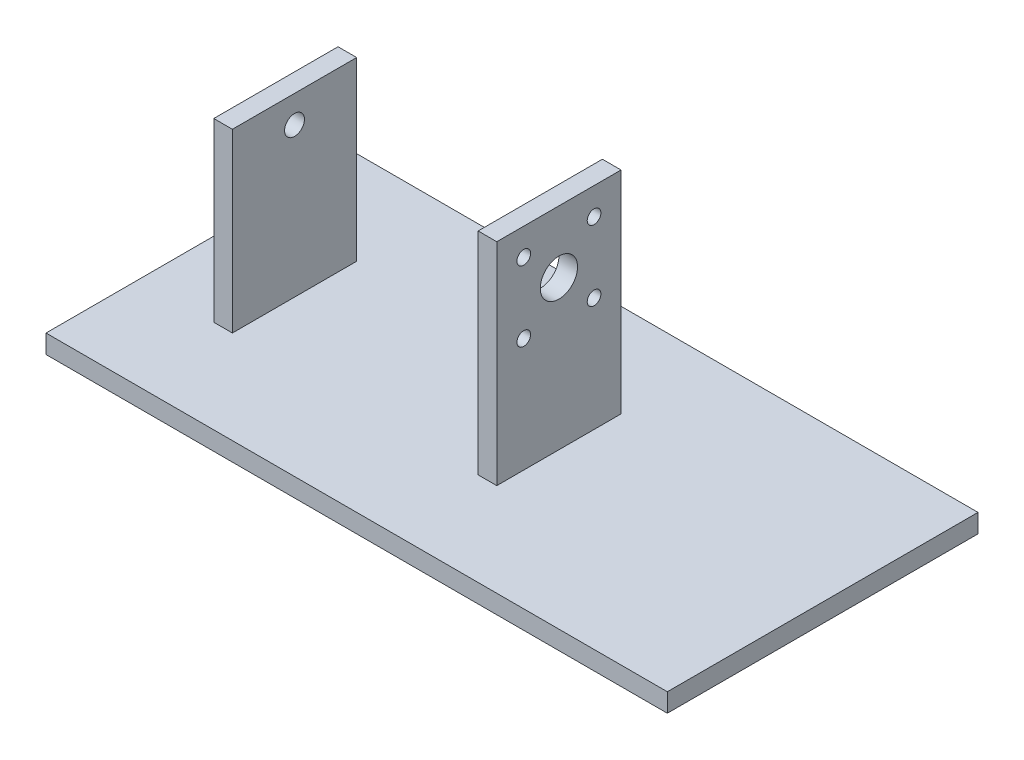
from build123d import *

# Parameters (mm, degrees)
SKETCH1_W           = 100
SKETCH1_H           = 50
SKETCH1_W_2         = 3
SKETCH1_H_2         = 20
BOSS_EXTRUDE1_DEPTH = 3
SKETCH1_3_W         = 3
SKETCH1_3_H         = 20
BOSS_EXTRUDE2_DEPTH = 37
SKETCH1_4_W         = 3
SKETCH1_4_H         = 20
BOSS_EXTRUDE3_DEPTH = 31.4
SKETCH2_R           = 3
SKETCH2_R_2         = 1.1
CUT_EXTRUDE1_DEPTH  = 3
CIRPATTERN1_COUNT   = 4
SKETCH3_R           = 1.6
CUT_EXTRUDE2_DEPTH  = 15


with BuildPart() as part:
    # Sketch1 → Boss-Extrude1 (new body)
    with BuildSketch(Plane(origin=(0, 0, 0), x_dir=(1, 0, 0), z_dir=(0, 1, 0))):
        Rectangle(SKETCH1_W, SKETCH1_H)
        with Locations((-36.5, 0)):
            Rectangle(SKETCH1_W_2, SKETCH1_H_2, mode=Mode.SUBTRACT)
        with Locations((6.05, 0)):
            Rectangle(SKETCH1_W_2, SKETCH1_H_2, mode=Mode.SUBTRACT)
    extrude(amount=BOSS_EXTRUDE1_DEPTH)

    # Sketch1<3> → Boss-Extrude2 (add)
    with BuildSketch(Plane(origin=(0, 0, 0), x_dir=(1, 0, 0), z_dir=(0, 1, 0))):
        with Locations((6.05, 0)):
            Rectangle(SKETCH1_3_W, SKETCH1_3_H)
    extrude(amount=BOSS_EXTRUDE2_DEPTH)

    # Sketch1<4> → Boss-Extrude3 (add)
    with BuildSketch(Plane(origin=(0, 0, 0), x_dir=(1, 0, 0), z_dir=(0, 1, 0))):
        with Locations((-36.5, 0)):
            Rectangle(SKETCH1_4_W, SKETCH1_4_H)
    extrude(amount=BOSS_EXTRUDE3_DEPTH)

    # Sketch2 → Cut-Extrude1 (cut)
    with BuildSketch(Plane(origin=(7.55, 0, 0), x_dir=(0, 0, -1), z_dir=(1, 0, 0))):
        with Locations((0, 27)):
            Circle(SKETCH2_R)
        with Locations((5.656854249, 32.656854249)):
            Circle(SKETCH2_R_2)
    cut_extrude1 = extrude(amount=-CUT_EXTRUDE1_DEPTH, mode=Mode.SUBTRACT)

    # CirPattern1: Cut-Extrude1 ×4 about axis
    cirpattern1_axis = Axis((0, 27, 0), (1, 0, 0))
    for i in range(1, CIRPATTERN1_COUNT):
        add(cut_extrude1.rotate(cirpattern1_axis, i * 360 / CIRPATTERN1_COUNT), mode=Mode.SUBTRACT)

    # Sketch3 → Cut-Extrude2 (cut)
    with BuildSketch(Plane.ZY.offset(50)):
        with Locations((0, 27)):
            Circle(SKETCH3_R)
    extrude(amount=-CUT_EXTRUDE2_DEPTH, mode=Mode.SUBTRACT)


solid = part.part
